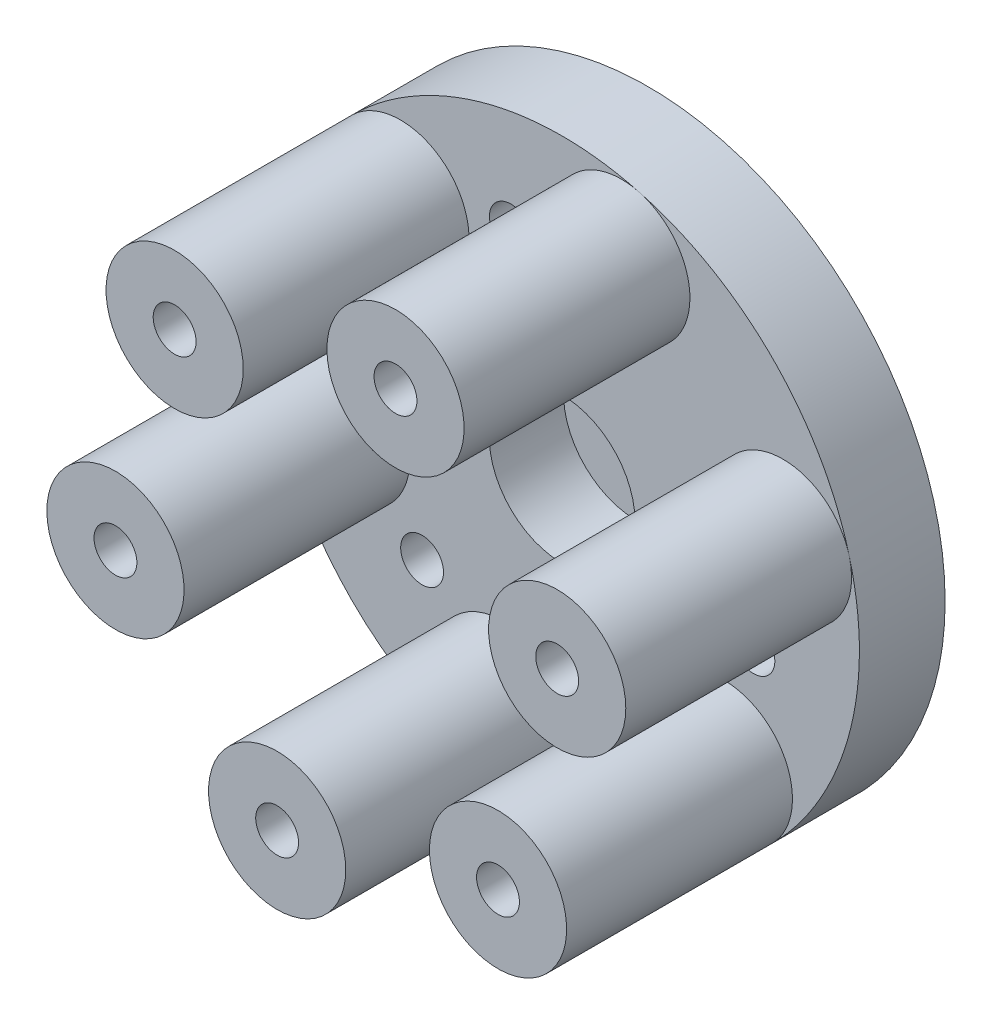
from build123d import *

# Parameters (mm, degrees)
SKETCH_1_R               = 10.4
EXTRUDE_1_DEPTH          = 3
SKETCH_3_R               = 2.4
SKETCH_3_R_2             = 0.75
EXTRUDE_3_DEPTH          = 7.9
PATTERN_CIRCULAR_1_COUNT = 6
SKETCH_4_R               = 0.75
CUT_EXTRUDE_1_DEPTH      = 17.695208894
PATTERN_CIRCULAR_2_COUNT = 3
SKETCH_5_R               = 1.1
CUT_EXTRUDE_2_DEPTH      = 17.695208894
SKETCH_5_4_R             = 2.55
SKETCH_5_4_R_2           = 1.1
CUT_EXTRUDE_3_DEPTH      = 2.6


with BuildPart() as part:
    # 草图1 → 凸台-拉伸1 (new body)
    with BuildSketch(Plane.XY):
        Circle(SKETCH_1_R)
    extrude(amount=EXTRUDE_1_DEPTH)

    # 草图3 → 凸台-拉伸3 (add)
    with BuildSketch(Plane.XY.offset(3)):
        with Locations((-5.656854249, 5.656854249)):
            Circle(SKETCH_3_R)
        with Locations((-5.656854249, 5.656854249)):
            Circle(SKETCH_3_R_2, mode=Mode.SUBTRACT)
    extrude_3 = extrude(amount=EXTRUDE_3_DEPTH)

    # 阵列(圆周)1: 凸台-拉伸3 ×6 about axis
    pattern_circular_1_axis = Axis((0, 0, 3), (0, 0, -1))
    for i in range(1, PATTERN_CIRCULAR_1_COUNT):
        add(extrude_3.rotate(pattern_circular_1_axis, i * 360 / PATTERN_CIRCULAR_1_COUNT))

    # 草图4 → 切除-拉伸1 (cut, through all)
    with BuildSketch(Plane.XY.offset(3)):
        with Locations((-1.793150944, 6.69213043)):
            Circle(SKETCH_4_R)
    cut_extrude_1 = extrude(amount=-CUT_EXTRUDE_1_DEPTH, mode=Mode.SUBTRACT)

    # 阵列(圆周)2: 切除-拉伸1 ×3 about axis
    pattern_circular_2_axis = Axis((0, 0, 3), (0, 0, -1))
    for i in range(1, PATTERN_CIRCULAR_2_COUNT):
        add(cut_extrude_1.rotate(pattern_circular_2_axis, i * 360 / PATTERN_CIRCULAR_2_COUNT), mode=Mode.SUBTRACT)

    # 草图5 → 切除-拉伸2 (cut, through all)
    with BuildSketch(Plane.XY.offset(3)):
        Circle(SKETCH_5_R)
    extrude(amount=-CUT_EXTRUDE_2_DEPTH, mode=Mode.SUBTRACT)

    # 草图5<4> → 切除-拉伸3 (cut)
    with BuildSketch(Plane.XY.offset(3)):
        Circle(SKETCH_5_4_R)
        Circle(SKETCH_5_4_R_2, mode=Mode.SUBTRACT)
    extrude(amount=-CUT_EXTRUDE_3_DEPTH, mode=Mode.SUBTRACT)


solid = part.part
